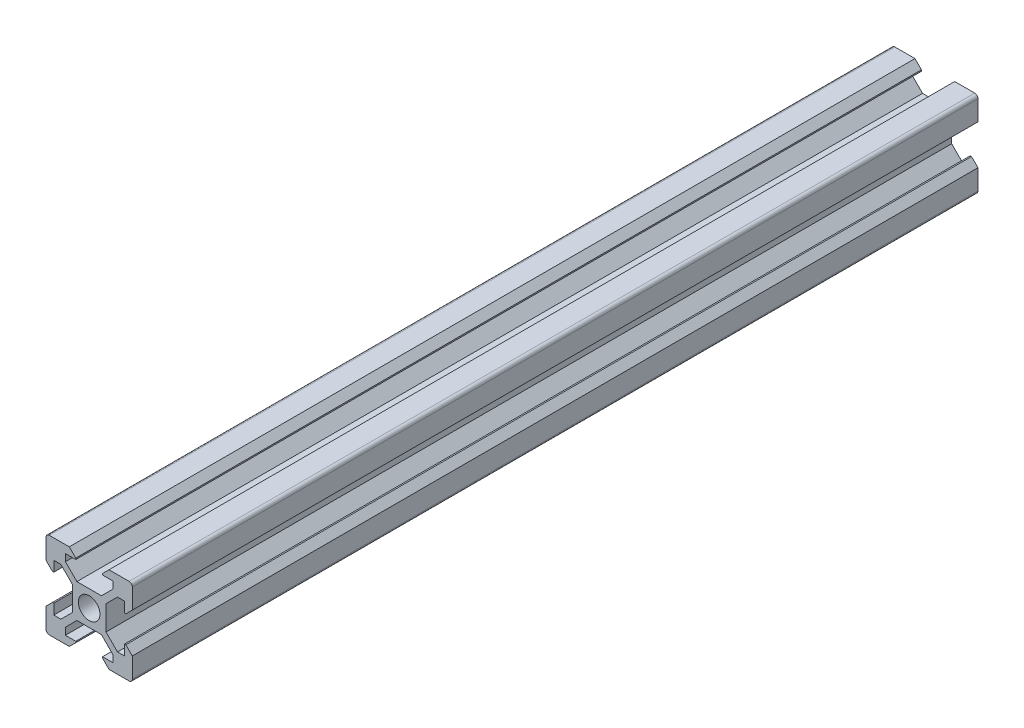
from build123d import *

# Parameters (mm, degrees)
CROQUIS1_R              = 2.5
SALIENTE_EXTRUIR1_DEPTH = 195.95


with BuildPart() as part:
    # Croquis1 → Saliente-Extruir1 (new body)
    with BuildSketch(Plane.XY):
        with BuildLine():
            Line((-4.6, 10), (-3.1, 8.5))
            Line((-3.1, 8.5), (-3.1, 8.2))
            Line((-3.1, 8.2), (-5.5, 8.2))
            Line((-5.5, 8.2), (-5.5, 6.560660172))
            Line((-5.5, 6.560660172), (-2.84, 3.900660172))
            Line((-2.84, 3.900660172), (0, 3.900660172))
            Line((0, 3.900660172), (2.84, 3.900660172))
            Line((2.84, 3.900660172), (5.5, 6.560660172))
            Line((5.5, 6.560660172), (5.5, 8.2))
            Line((5.5, 8.2), (3.1, 8.2))
            Line((3.1, 8.2), (3.1, 8.5))
            Line((3.1, 8.5), (4.6, 10))
            Line((4.6, 10), (9.25, 10))
            ThreePointArc((9.25, 10), (9.780330086, 9.780330086), (10, 9.25))
            Line((10, 9.25), (10, 4.6))
            Line((10, 4.6), (8.5, 3.1))
            Line((8.5, 3.1), (8.2, 3.1))
            Line((8.2, 3.1), (8.2, 5.5))
            Line((8.2, 5.5), (6.560660172, 5.5))
            Line((6.560660172, 5.5), (3.900660172, 2.84))
            Line((3.900660172, 2.84), (3.900660172, 0))
            Line((3.900660172, 0), (3.900660172, -2.84))
            Line((3.900660172, -2.84), (6.560660172, -5.5))
            Line((6.560660172, -5.5), (8.2, -5.5))
            Line((8.2, -5.5), (8.2, -3.1))
            Line((8.2, -3.1), (8.5, -3.1))
            Line((8.5, -3.1), (10, -4.6))
            Line((10, -4.6), (10, -9.25))
            ThreePointArc((10, -9.25), (9.780330086, -9.780330086), (9.25, -10))
            Line((9.25, -10), (4.6, -10))
            Line((4.6, -10), (3.1, -8.5))
            Line((3.1, -8.5), (3.1, -8.2))
            Line((3.1, -8.2), (5.5, -8.2))
            Line((5.5, -8.2), (5.5, -6.560660172))
            Line((5.5, -6.560660172), (2.84, -3.900660172))
            Line((2.84, -3.900660172), (0, -3.900660172))
            Line((0, -3.900660172), (-2.84, -3.900660172))
            Line((-2.84, -3.900660172), (-5.5, -6.560660172))
            Line((-5.5, -6.560660172), (-5.5, -8.2))
            Line((-5.5, -8.2), (-3.1, -8.2))
            Line((-3.1, -8.2), (-3.1, -8.5))
            Line((-3.1, -8.5), (-4.6, -10))
            Line((-4.6, -10), (-9.25, -10))
            ThreePointArc((-9.25, -10), (-9.780330086, -9.780330086), (-10, -9.25))
            Line((-10, -9.25), (-10, -4.6))
            Line((-10, -4.6), (-8.5, -3.1))
            Line((-8.5, -3.1), (-8.2, -3.1))
            Line((-8.2, -3.1), (-8.2, -5.5))
            Line((-8.2, -5.5), (-6.560660172, -5.5))
            Line((-6.560660172, -5.5), (-3.900660172, -2.84))
            Line((-3.900660172, -2.84), (-3.900660172, 0))
            Line((-3.900660172, 0), (-3.900660172, 2.84))
            Line((-3.900660172, 2.84), (-6.560660172, 5.5))
            Line((-6.560660172, 5.5), (-8.2, 5.5))
            Line((-8.2, 5.5), (-8.2, 3.1))
            Line((-8.2, 3.1), (-8.5, 3.1))
            Line((-8.5, 3.1), (-10, 4.6))
            Line((-10, 4.6), (-10, 9.25))
            ThreePointArc((-10, 9.25), (-9.780330086, 9.780330086), (-9.25, 10))
            Line((-9.25, 10), (-4.6, 10))
        make_face()
        Circle(CROQUIS1_R, mode=Mode.SUBTRACT)
    extrude(amount=SALIENTE_EXTRUIR1_DEPTH)


solid = part.part
